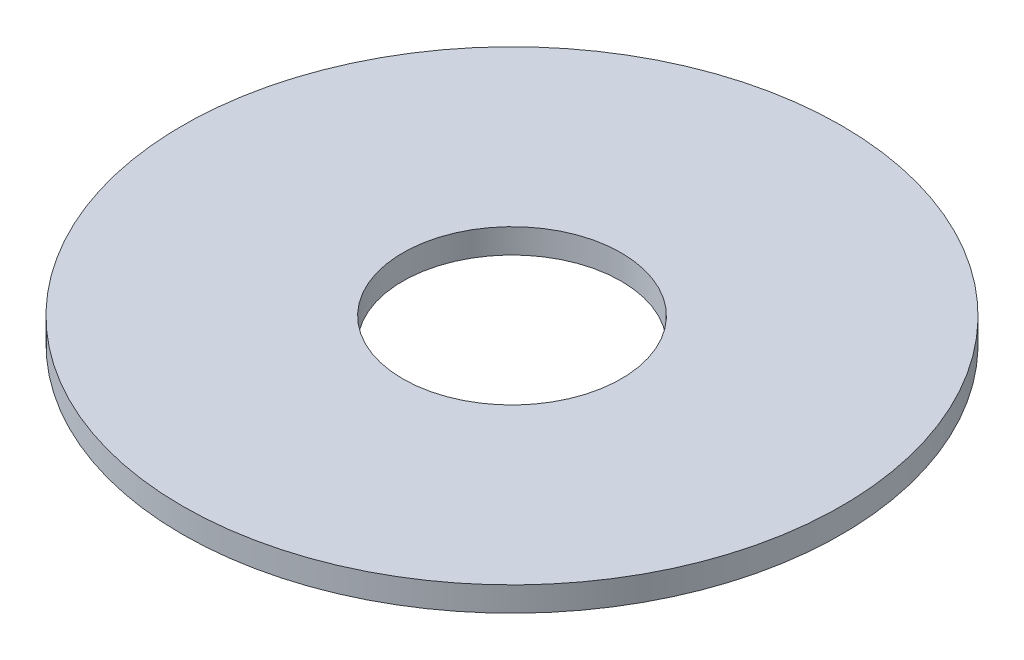
from build123d import *

# Parameters (mm, degrees)
SKETCH1_R           = 134.275
SKETCH1_R_2         = 44.5
BOSS_EXTRUDE1_DEPTH = 10


with BuildPart() as part:
    # Sketch1 → Boss-Extrude1 (new body)
    with BuildSketch(Plane(origin=(0, 0, 0), x_dir=(1, 0, 0), z_dir=(0, 1, 0))):
        with Locations(Location((0, 0, 0), (0, 0, 270))):
            Circle(SKETCH1_R)
        with Locations(Location((0, 0, 0), (0, 0, 270))):
            Circle(SKETCH1_R_2, mode=Mode.SUBTRACT)
    extrude(amount=BOSS_EXTRUDE1_DEPTH)


solid = part.part
